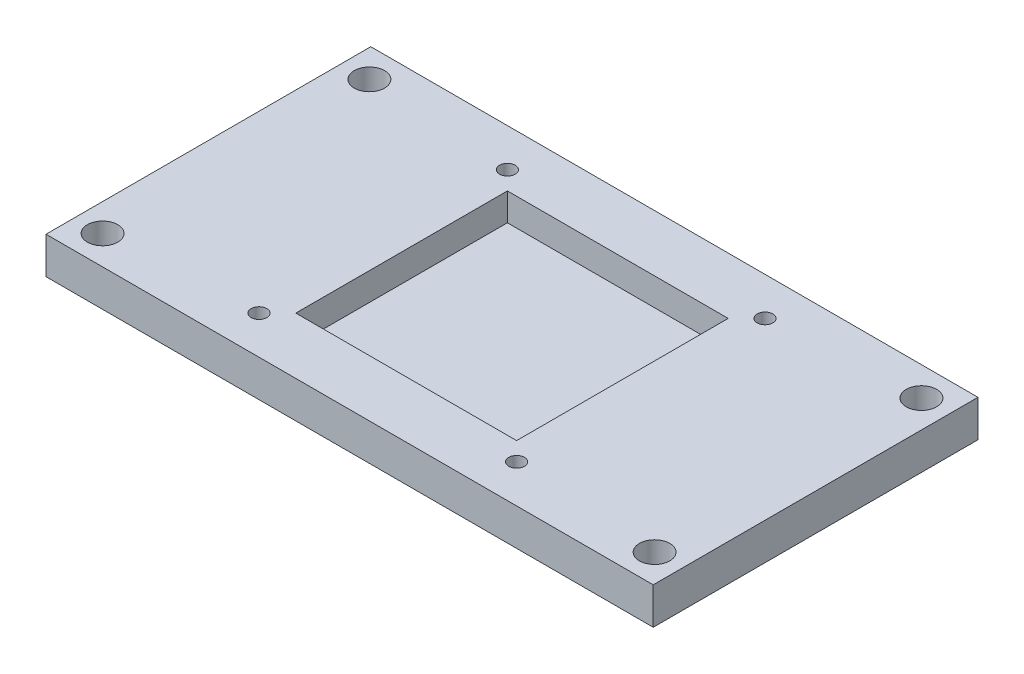
from build123d import *

# Parameters (mm, degrees)
SKETCH1_W           = 66
SKETCH1_H           = 35.3
SKETCH1_R           = 1.65
BOSS_EXTRUDE1_DEPTH = 4
SKETCH2_R           = 0.85
CUT_EXTRUDE1_DEPTH  = 4
SKETCH3_W           = 24
SKETCH3_H           = 23
CUT_EXTRUDE2_DEPTH  = 3


with BuildPart() as part:
    # Sketch1 → Boss-Extrude1 (new body)
    with BuildSketch(Plane(origin=(0, 0, 0), x_dir=(1, 0, 0), z_dir=(0, 1, 0))):
        with Locations((33, 17.65)):
            Rectangle(SKETCH1_W, SKETCH1_H)
        with Locations(Location((3, 32.15, 0), (0, 0, 270))):
            Circle(SKETCH1_R, mode=Mode.SUBTRACT)
        with Locations(Location((3, 3.15, 0), (0, 0, 270))):
            Circle(SKETCH1_R, mode=Mode.SUBTRACT)
        with Locations(Location((63, 3.15, 0), (0, 0, 270))):
            Circle(SKETCH1_R, mode=Mode.SUBTRACT)
        with Locations(Location((63, 32.15, 0), (0, 0, 270))):
            Circle(SKETCH1_R, mode=Mode.SUBTRACT)
    extrude(amount=BOSS_EXTRUDE1_DEPTH)

    # Sketch2 → Cut-Extrude1 (cut)
    with BuildSketch(Plane(origin=(0, 4, 0), x_dir=(1, 0, 0), z_dir=(0, 1, 0))):
        with Locations(Location((19, 31.15, 0), (0, 0, 270))):
            Circle(SKETCH2_R)
        with Locations(Location((47, 31.15, 0), (0, 0, 270))):
            Circle(SKETCH2_R)
        with Locations(Location((47, 4.15, 0), (0, 0, 270))):
            Circle(SKETCH2_R)
        with Locations(Location((19, 4.15, 0), (0, 0, 270))):
            Circle(SKETCH2_R)
    extrude(amount=-CUT_EXTRUDE1_DEPTH, mode=Mode.SUBTRACT)

    # Sketch3 → Cut-Extrude2 (cut)
    with BuildSketch(Plane(origin=(0, 4, 0), x_dir=(1, 0, 0), z_dir=(0, 1, 0))):
        with Locations((33, 17.65)):
            Rectangle(SKETCH3_W, SKETCH3_H)
    extrude(amount=-CUT_EXTRUDE2_DEPTH, mode=Mode.SUBTRACT)


solid = part.part
